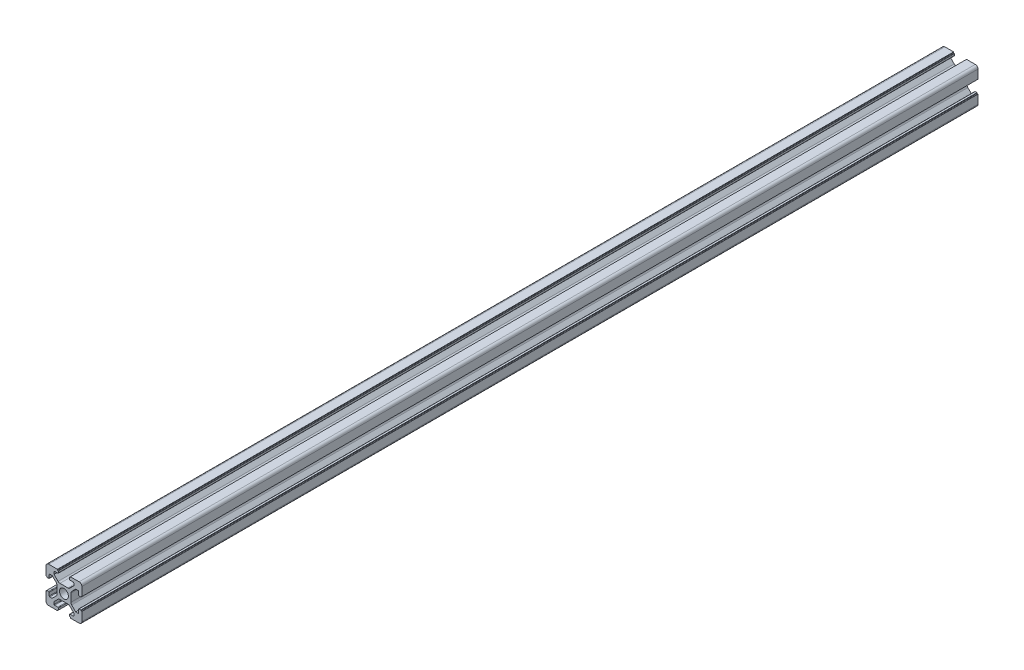
from build123d import *

# Parameters (mm, degrees)
SKETCH_1_R      = 2.5
EXTRUDE_1_DEPTH = 500


with BuildPart() as part:
    # 草图1 → 凸台-拉伸1 (new body)
    with BuildSketch(Plane.XY):
        with BuildLine():
            Line((4.215995631, 3.244230202), (6.436655803, 5.464890373))
            Line((6.436655803, 5.464890373), (7.776655803, 5.464890373))
            ThreePointArc((7.776655803, 5.464890373), (7.988787838, 5.377022408), (8.076655803, 5.164890373))
            Line((8.076655803, 5.164890373), (8.076655803, 3.364890373))
            ThreePointArc((8.076655803, 3.364890373), (8.164523769, 3.152758339), (8.376655803, 3.064890373))
            Line((8.376655803, 3.064890373), (9.376655803, 3.064890373))
            Line((9.376655803, 3.064890373), (9.376655803, 3.364890373))
            ThreePointArc((9.376655803, 3.364890373), (9.435234447, 3.50631173), (9.576655803, 3.564890373))
            Line((9.576655803, 3.564890373), (9.876655803, 3.564890373))
            Line((9.876655803, 3.564890373), (9.876655803, 8.464890373))
            ThreePointArc((9.876655803, 8.464890373), (9.437315975, 9.525550545), (8.376655803, 9.964890373))
            Line((8.376655803, 9.964890373), (3.476655803, 9.964890373))
            Line((3.476655803, 9.964890373), (3.476655803, 9.664890373))
            ThreePointArc((3.476655803, 9.664890373), (3.418077159, 9.523469017), (3.276655803, 9.464890373))
            Line((3.276655803, 9.464890373), (2.976655803, 9.464890373))
            Line((2.976655803, 9.464890373), (2.976655803, 8.464890373))
            ThreePointArc((2.976655803, 8.464890373), (3.064523769, 8.252758339), (3.276655803, 8.164890373))
            Line((3.276655803, 8.164890373), (5.076655803, 8.164890373))
            ThreePointArc((5.076655803, 8.164890373), (5.288787838, 8.077022408), (5.376655803, 7.864890373))
            Line((5.376655803, 7.864890373), (5.376655803, 6.524890373))
            Line((5.376655803, 6.524890373), (3.155995631, 4.304230202))
            ThreePointArc((3.155995631, 4.304230202), (2.669360608, 3.979071075), (2.09533546, 3.864890373))
            Line((2.09533546, 3.864890373), (-2.342023853, 3.864890373))
            ThreePointArc((-2.342023853, 3.864890373), (-2.916049002, 3.979071075), (-3.402684025, 4.304230202))
            Line((-3.402684025, 4.304230202), (-5.623344197, 6.524890373))
            Line((-5.623344197, 6.524890373), (-5.623344197, 7.864890373))
            ThreePointArc((-5.623344197, 7.864890373), (-5.535476231, 8.077022408), (-5.323344197, 8.164890373))
            Line((-5.323344197, 8.164890373), (-3.523344197, 8.164890373))
            ThreePointArc((-3.523344197, 8.164890373), (-3.311212162, 8.252758339), (-3.223344197, 8.464890373))
            Line((-3.223344197, 8.464890373), (-3.223344197, 9.464890373))
            Line((-3.223344197, 9.464890373), (-3.523344197, 9.464890373))
            ThreePointArc((-3.523344197, 9.464890373), (-3.664765553, 9.523469017), (-3.723344197, 9.664890373))
            Line((-3.723344197, 9.664890373), (-3.723344197, 9.964890373))
            Line((-3.723344197, 9.964890373), (-8.623344197, 9.964890373))
            ThreePointArc((-8.623344197, 9.964890373), (-9.684004369, 9.525550545), (-10.123344197, 8.464890373))
            Line((-10.123344197, 8.464890373), (-10.123344197, 3.564890373))
            Line((-10.123344197, 3.564890373), (-9.823344197, 3.564890373))
            ThreePointArc((-9.823344197, 3.564890373), (-9.681922841, 3.50631173), (-9.623344197, 3.364890373))
            Line((-9.623344197, 3.364890373), (-9.623344197, 3.064890373))
            Line((-9.623344197, 3.064890373), (-8.623344197, 3.064890373))
            ThreePointArc((-8.623344197, 3.064890373), (-8.411212162, 3.152758339), (-8.323344197, 3.364890373))
            Line((-8.323344197, 3.364890373), (-8.323344197, 5.164890373))
            ThreePointArc((-8.323344197, 5.164890373), (-8.235476231, 5.377022408), (-8.023344197, 5.464890373))
            Line((-8.023344197, 5.464890373), (-6.683344197, 5.464890373))
            Line((-6.683344197, 5.464890373), (-4.462684025, 3.244230202))
            ThreePointArc((-4.462684025, 3.244230202), (-4.137524898, 2.757595178), (-4.023344197, 2.18357003))
            Line((-4.023344197, 2.18357003), (-4.023344197, -2.253789283))
            ThreePointArc((-4.023344197, -2.253789283), (-4.137524898, -2.827814432), (-4.462684025, -3.314449455))
            Line((-4.462684025, -3.314449455), (-6.683344197, -5.535109627))
            Line((-6.683344197, -5.535109627), (-8.023344197, -5.535109627))
            ThreePointArc((-8.023344197, -5.535109627), (-8.235476231, -5.447241661), (-8.323344197, -5.235109627))
            Line((-8.323344197, -5.235109627), (-8.323344197, -3.435109627))
            ThreePointArc((-8.323344197, -3.435109627), (-8.411212162, -3.222977592), (-8.623344197, -3.135109627))
            Line((-8.623344197, -3.135109627), (-9.623344197, -3.135109627))
            Line((-9.623344197, -3.135109627), (-9.623344197, -3.435109627))
            ThreePointArc((-9.623344197, -3.435109627), (-9.681922841, -3.576530983), (-9.823344197, -3.635109627))
            Line((-9.823344197, -3.635109627), (-10.123344197, -3.635109627))
            Line((-10.123344197, -3.635109627), (-10.123344197, -8.535109627))
            ThreePointArc((-10.123344197, -8.535109627), (-9.684004369, -9.595769798), (-8.623344197, -10.035109627))
            Line((-8.623344197, -10.035109627), (-3.723344197, -10.035109627))
            Line((-3.723344197, -10.035109627), (-3.723344197, -9.735109627))
            ThreePointArc((-3.723344197, -9.735109627), (-3.664765553, -9.59368827), (-3.523344197, -9.535109627))
            Line((-3.523344197, -9.535109627), (-3.223344197, -9.535109627))
            Line((-3.223344197, -9.535109627), (-3.223344197, -8.535109627))
            ThreePointArc((-3.223344197, -8.535109627), (-3.311212162, -8.322977592), (-3.523344197, -8.235109627))
            Line((-3.523344197, -8.235109627), (-5.323344197, -8.235109627))
            ThreePointArc((-5.323344197, -8.235109627), (-5.535476231, -8.147241661), (-5.623344197, -7.935109627))
            Line((-5.623344197, -7.935109627), (-5.623344197, -6.595109627))
            Line((-5.623344197, -6.595109627), (-3.402684025, -4.374449455))
            ThreePointArc((-3.402684025, -4.374449455), (-2.916049002, -4.049290328), (-2.342023853, -3.935109627))
            Line((-2.342023853, -3.935109627), (2.09533546, -3.935109627))
            ThreePointArc((2.09533546, -3.935109627), (2.669360608, -4.049290328), (3.155995631, -4.374449455))
            Line((3.155995631, -4.374449455), (5.376655803, -6.595109627))
            Line((5.376655803, -6.595109627), (5.376655803, -7.935109627))
            ThreePointArc((5.376655803, -7.935109627), (5.288787838, -8.147241661), (5.076655803, -8.235109627))
            Line((5.076655803, -8.235109627), (3.276655803, -8.235109627))
            ThreePointArc((3.276655803, -8.235109627), (3.064523769, -8.322977592), (2.976655803, -8.535109627))
            Line((2.976655803, -8.535109627), (2.976655803, -9.535109627))
            Line((2.976655803, -9.535109627), (3.276655803, -9.535109627))
            ThreePointArc((3.276655803, -9.535109627), (3.418077159, -9.59368827), (3.476655803, -9.735109627))
            Line((3.476655803, -9.735109627), (3.476655803, -10.035109627))
            Line((3.476655803, -10.035109627), (8.376655803, -10.035109627))
            ThreePointArc((8.376655803, -10.035109627), (9.437315975, -9.595769798), (9.876655803, -8.535109627))
            Line((9.876655803, -8.535109627), (9.876655803, -3.635109627))
            Line((9.876655803, -3.635109627), (9.576655803, -3.635109627))
            ThreePointArc((9.576655803, -3.635109627), (9.435234447, -3.576530983), (9.376655803, -3.435109627))
            Line((9.376655803, -3.435109627), (9.376655803, -3.135109627))
            Line((9.376655803, -3.135109627), (8.376655803, -3.135109627))
            ThreePointArc((8.376655803, -3.135109627), (8.164523769, -3.222977592), (8.076655803, -3.435109627))
            Line((8.076655803, -3.435109627), (8.076655803, -5.235109627))
            ThreePointArc((8.076655803, -5.235109627), (7.988787838, -5.447241661), (7.776655803, -5.535109627))
            Line((7.776655803, -5.535109627), (6.436655803, -5.535109627))
            Line((6.436655803, -5.535109627), (4.215995631, -3.314449455))
            ThreePointArc((4.215995631, -3.314449455), (3.890836504, -2.827814432), (3.776655803, -2.253789283))
            Line((3.776655803, -2.253789283), (3.776655803, 2.18357003))
            ThreePointArc((3.776655803, 2.18357003), (3.890836504, 2.757595178), (4.215995631, 3.244230202))
        make_face()
        with Locations((-0.123344197, -0.035109627)):
            Circle(SKETCH_1_R, mode=Mode.SUBTRACT)
    extrude(amount=EXTRUDE_1_DEPTH)


solid = part.part
